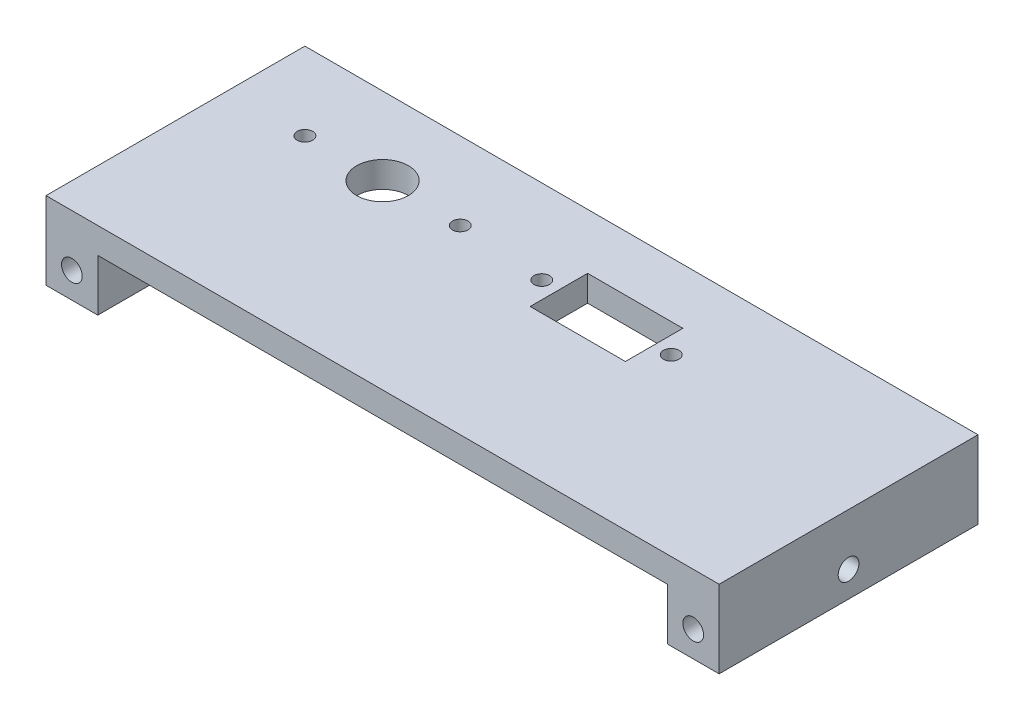
from build123d import *

# Parameters (mm, degrees)
ESBO_O1_W                = 130
ESBO_O1_H                = 50
RESSALTO_EXTRUS_O1_DEPTH = 15
ESBO_O2_W                = 110
ESBO_O2_H                = 10
CORTE_EXTRUS_O1_DEPTH    = 51
ESBO_O5_R                = 2
CORTE_EXTRUS_O2_DEPTH    = 10
CORTE_EXTRUS_O3_START    = -10
ESBO_O6_R                = 2
CORTE_EXTRUS_O3_DEPTH    = 10
ESBO_O7_R                = 2
CORTE_EXTRUS_O4_DEPTH    = 10
CORTE_EXTRUS_O5_START    = -10
ESBO_O8_R                = 2
CORTE_EXTRUS_O5_DEPTH    = 10
ESBO_O13_R               = 1.5
ESBO_O13_R_2             = 5
CORTE_EXTRUS_O8_DEPTH    = 10
ESBO_O14_R               = 1.5
ESBO_O14_W               = 18.4
ESBO_O14_H               = 11.1
CORTE_EXTRUS_O9_DEPTH    = 10


with BuildPart() as part:
    # Esboço1 → Ressalto-extrusão1 (new body)
    with BuildSketch(Plane(origin=(0, 0, 0), x_dir=(1, 0, 0), z_dir=(0, 1, 0))):
        with Locations((-65, 25)):
            Rectangle(ESBO_O1_W, ESBO_O1_H)
    extrude(amount=RESSALTO_EXTRUS_O1_DEPTH)

    # Esboço2 → Corte-extrusão1 (cut)
    with BuildSketch(Plane(origin=(0, 0, -50), x_dir=(-1, 0, 0), z_dir=(0, 0, -1))):
        with Locations((65, 5)):
            Rectangle(ESBO_O2_W, ESBO_O2_H)
    extrude(amount=-CORTE_EXTRUS_O1_DEPTH, mode=Mode.SUBTRACT)

    # Esboço5 → Corte-extrusão2 (cut)
    with BuildSketch(Plane(origin=(0, 0, -50), x_dir=(-1, 0, 0), z_dir=(0, 0, -1))):
        with Locations((125, 5)):
            Circle(ESBO_O5_R)
        with Locations((5, 5)):
            Circle(ESBO_O5_R)
    extrude(amount=-CORTE_EXTRUS_O2_DEPTH, mode=Mode.SUBTRACT)

    # Esboço6 → Corte-extrusão3 (cut)
    with BuildSketch(Plane.XY.offset(CORTE_EXTRUS_O3_START)):
        with Locations(Location((-125, 5, 0), (0, 0, 180))):
            Circle(ESBO_O6_R)
        with Locations(Location((-5, 5, 0), (0, 0, 180))):
            Circle(ESBO_O6_R)
    extrude(amount=CORTE_EXTRUS_O3_DEPTH, mode=Mode.SUBTRACT)

    # Esboço7 → Corte-extrusão4 (cut)
    with BuildSketch(Plane(origin=(0, 0, 0), x_dir=(0, 0, -1), z_dir=(1, 0, 0))):
        with Locations((25, 5)):
            Circle(ESBO_O7_R)
    extrude(amount=-CORTE_EXTRUS_O4_DEPTH, mode=Mode.SUBTRACT)

    # Esboço8 → Corte-extrusão5 (cut)
    with BuildSketch(Plane.ZY.offset(130).offset(CORTE_EXTRUS_O5_START)):
        with Locations(Location((-25, 5, 0), (0, 0, 180))):
            Circle(ESBO_O8_R)
    extrude(amount=CORTE_EXTRUS_O5_DEPTH, mode=Mode.SUBTRACT)

    # Esboço13 → Corte-extrusão8 (cut)
    with BuildSketch(Plane(origin=(0, 15, 0), x_dir=(1, 0, 0), z_dir=(0, 1, 0))):
        with Locations(Location((-115, 35, 0), (0, 0, 270))):
            Circle(ESBO_O13_R)
        with Locations(Location((-100, 35, 0), (0, 0, 270))):
            Circle(ESBO_O13_R_2)
        with Locations(Location((-85, 35, 0), (0, 0, 270))):
            Circle(ESBO_O13_R)
    extrude(amount=-CORTE_EXTRUS_O8_DEPTH, mode=Mode.SUBTRACT)

    # Esboço14 → Corte-extrusão9 (cut)
    with BuildSketch(Plane(origin=(0, 15, 0), x_dir=(1, 0, 0), z_dir=(0, 1, 0))):
        with Locations(Location((-68, 33.75, 0), (0, 0, 270))):
            Circle(ESBO_O14_R)
        with Locations(Location((-43, 33.75, 0), (0, 0, 270))):
            Circle(ESBO_O14_R)
        with Locations((-55.5, 33.75)):
            Rectangle(ESBO_O14_W, ESBO_O14_H)
    extrude(amount=-CORTE_EXTRUS_O9_DEPTH, mode=Mode.SUBTRACT)


solid = part.part
